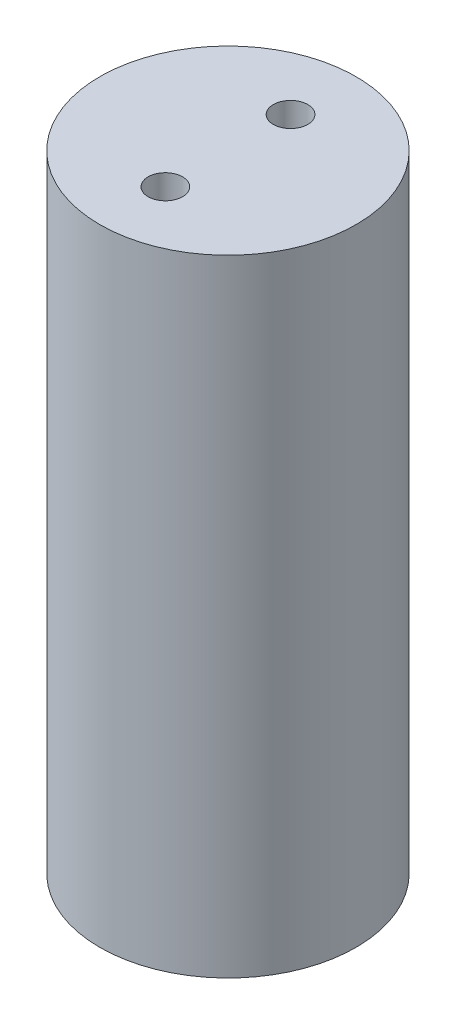
from build123d import *

# Parameters (mm, degrees)
SKETCH1_R           = 2.6
BOSS_EXTRUDE1_DEPTH = 6.35
SKETCH2_R           = 0.35
CUT_EXTRUDE1_DEPTH  = 6.35


with BuildPart() as part:
    # Sketch1 → Boss-Extrude1 (new, symmetric)
    with BuildSketch(Plane(origin=(0, 0, 0), x_dir=(1, 0, 0), z_dir=(0, 1, 0))):
        with Locations(Location((0, 0, 0), (0, 0, 270))):
            Circle(SKETCH1_R)
    extrude(amount=BOSS_EXTRUDE1_DEPTH, both=True)

    # Sketch2 → Cut-Extrude1 (cut, symmetric)
    with BuildSketch(Plane(origin=(0, 0, 0), x_dir=(1, 0, 0), z_dir=(0, 1, 0))):
        with Locations(Location((0, -1.27, 0), (0, 0, 270))):
            Circle(SKETCH2_R)
        with Locations(Location((0, 1.27, 0), (0, 0, 270))):
            Circle(SKETCH2_R)
    extrude(amount=CUT_EXTRUDE1_DEPTH, both=True, mode=Mode.SUBTRACT)


solid = part.part
